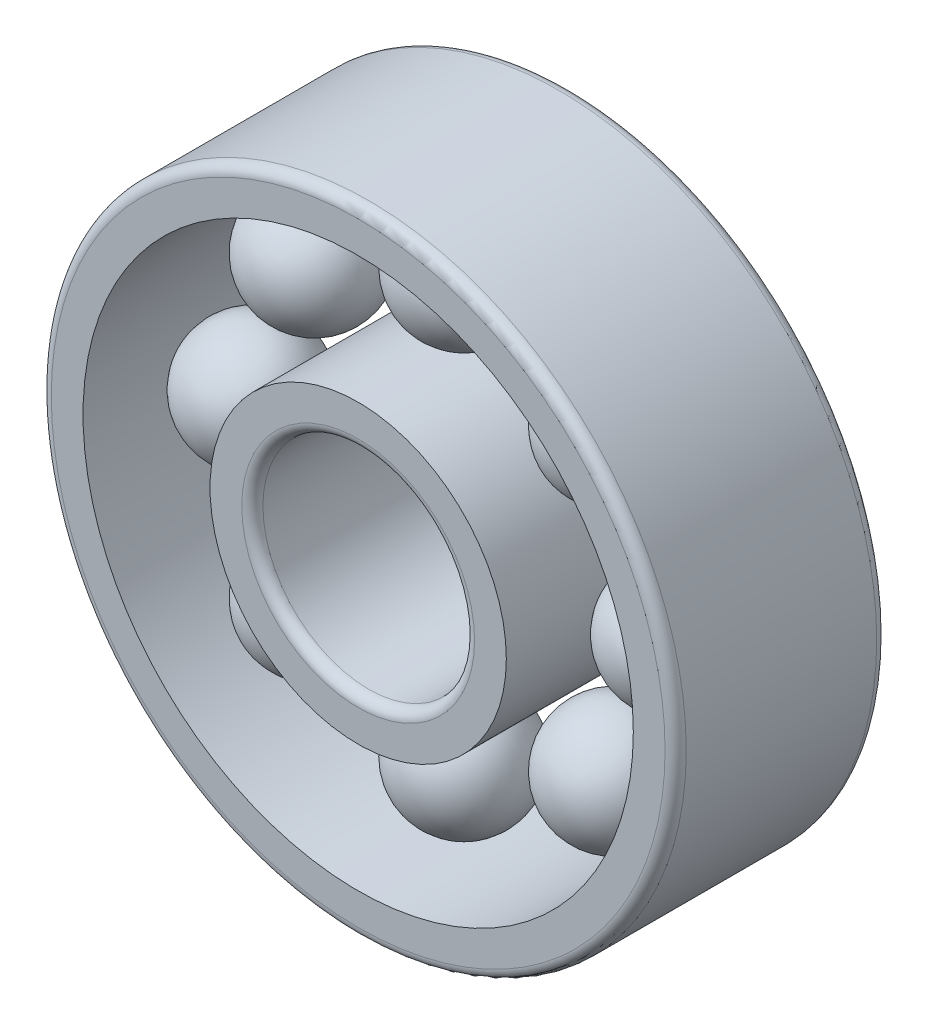
from build123d import *

# Parameters (mm, degrees)
INNERS_W           = 0.2
INNERS_H           = 1
OUTERS_W           = 0.2
OUTERS_H           = 1
BALLSPATTERN_COUNT = 8
FILLET_F1_R        = 0.05
FILLET_F2_R        = 0.05


with BuildPart() as part:
    # InnerS → InnerRing (revolve)
    with BuildSketch(Plane(origin=(0, 0, 0), x_dir=(1, 0, 0), z_dir=(0, 1, 0))):
        with Locations((0.6, 0)):
            Rectangle(INNERS_W, INNERS_H)
    revolve(axis=Axis((0, 0, 1.75), (0, 0, -1)))

    # Fillet F2
    fillet_f2_edges = [part.edges().sort_by_distance(p)[0] for p in [
        (-0.5, 0, -0.5),
        (-0.5, 0, 0.5),
    ]]
    fillet(fillet_f2_edges, radius=FILLET_F2_R)


with BuildPart() as body_2:
    # OuterS → OuterRing (revolve)
    with BuildSketch(Plane(origin=(0, 0, 0), x_dir=(1, 0, 0), z_dir=(0, 1, 0))):
        with Locations((1.4, 0)):
            Rectangle(OUTERS_W, OUTERS_H)
    revolve(axis=Axis((0, 0, 1.75), (0, 0, -1)))

    # Fillet F1
    fillet_f1_edges = [body_2.edges().sort_by_distance(p)[0] for p in [
        (-1.5, 0, -0.5),
        (-1.5, 0, 0.5),
    ]]
    fillet(fillet_f1_edges, radius=FILLET_F1_R)


with BuildPart() as body_3:
    # BallS → Ball (revolve)
    with BuildSketch(Plane(origin=(0, 0, 0), x_dir=(1, 0, 0), z_dir=(0, 1, 0))):
        with BuildLine():
            Line((0.715, 0), (1.285, 0))
            ThreePointArc((1.285, 0), (1, -0.285), (0.715, 0))
        make_face()
    revolve(axis=Axis((0.715, 0, 0), (1, 0, 0)))


with BuildPart() as ballspattern_1:
    # BallsPattern: pattern copy
    add(body_3.part.rotate(Axis((0, 0, -0.55), (0, 0, 1)), 1 * 360 / BALLSPATTERN_COUNT))


with BuildPart() as ballspattern_2:
    # BallsPattern: pattern copy
    add(body_3.part.rotate(Axis((0, 0, -0.55), (0, 0, 1)), 2 * 360 / BALLSPATTERN_COUNT))


with BuildPart() as ballspattern_3:
    # BallsPattern: pattern copy
    add(body_3.part.rotate(Axis((0, 0, -0.55), (0, 0, 1)), 3 * 360 / BALLSPATTERN_COUNT))


with BuildPart() as ballspattern_4:
    # BallsPattern: pattern copy
    add(body_3.part.rotate(Axis((0, 0, -0.55), (0, 0, 1)), 4 * 360 / BALLSPATTERN_COUNT))


with BuildPart() as ballspattern_5:
    # BallsPattern: pattern copy
    add(body_3.part.rotate(Axis((0, 0, -0.55), (0, 0, 1)), 5 * 360 / BALLSPATTERN_COUNT))


with BuildPart() as ballspattern_6:
    # BallsPattern: pattern copy
    add(body_3.part.rotate(Axis((0, 0, -0.55), (0, 0, 1)), 6 * 360 / BALLSPATTERN_COUNT))


with BuildPart() as ballspattern_7:
    # BallsPattern: pattern copy
    add(body_3.part.rotate(Axis((0, 0, -0.55), (0, 0, 1)), 7 * 360 / BALLSPATTERN_COUNT))


solid = Compound([part.part, body_2.part, body_3.part, ballspattern_1.part, ballspattern_2.part, ballspattern_3.part, ballspattern_4.part, ballspattern_5.part, ballspattern_6.part, ballspattern_7.part])
